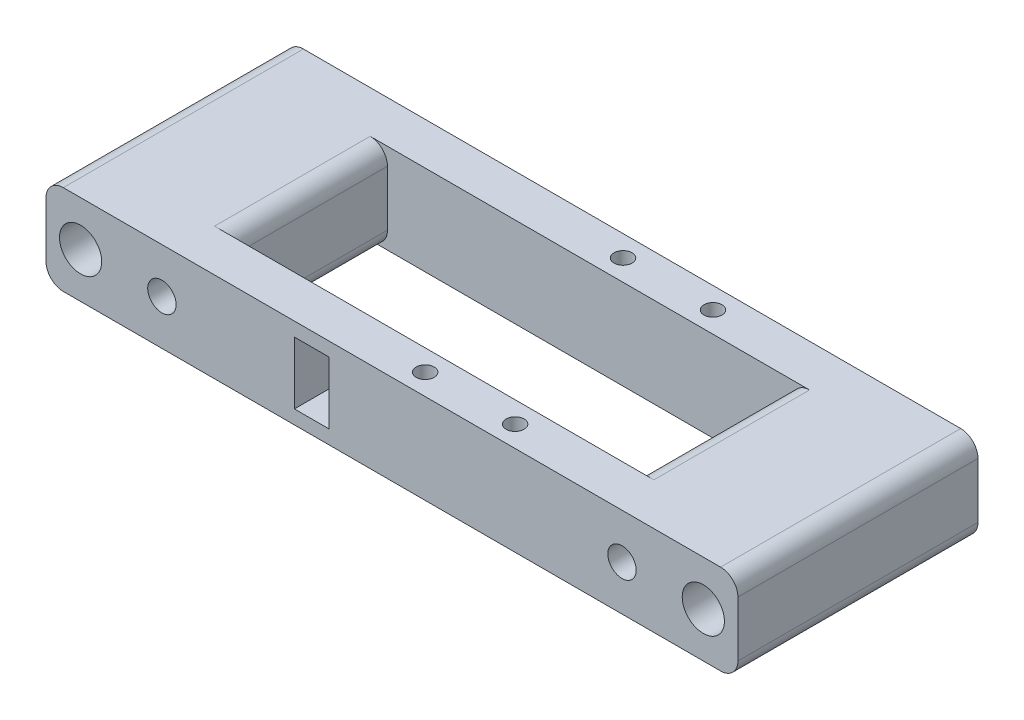
from build123d import *

# Parameters (mm, degrees)
SKETCH1_W           = 100
SKETCH1_H           = 26
SKETCH1_R           = 6.1
SKETCH1_R_2         = 4.1
BOSS_EXTRUDE1_DEPTH = 40
SKETCH2_W           = 100
SKETCH2_H           = 26
BOSS_EXTRUDE2_DEPTH = 29.4
CUT_EXTRUDE1_REACH  = 112.797
SKETCH3_W           = 58.5
SKETCH3_H           = 45
SKETCH4_R           = 2.6
CUT_EXTRUDE2_DEPTH  = 111.797111876
CUT_EXTRUDE3_DEPTH  = 4
CUT_EXTRUDE4_START  = -12.2
SKETCH6_W           = 10
SKETCH6_H           = 18
CUT_EXTRUDE4_DEPTH  = 12.2
FILLET1_R           = 5


with BuildPart() as part:
    # Sketch1 → Boss-Extrude1 (new body)
    with BuildSketch(Plane.XY):
        with Locations((-50, 13)):
            Rectangle(SKETCH1_W, SKETCH1_H)
        with Locations((-90, 13)):
            Circle(SKETCH1_R, mode=Mode.SUBTRACT)
        with Locations((-66.5, 13)):
            Circle(SKETCH1_R_2, mode=Mode.SUBTRACT)
    boss_extrude1 = extrude(amount=BOSS_EXTRUDE1_DEPTH)

    # Sketch2 → Boss-Extrude2 (add)
    with BuildSketch(Plane(origin=(0, 0, 0), x_dir=(-1, 0, 0), z_dir=(0, 0, -1))):
        with Locations((50, 13)):
            Rectangle(SKETCH2_W, SKETCH2_H)
    boss_extrude2 = extrude(amount=BOSS_EXTRUDE2_DEPTH)

    # Sketch3 → Cut-Extrude1 (cut, up to next)
    with BuildSketch(Plane(origin=(0, 26, 0), x_dir=(1, 0, 0), z_dir=(0, 1, 0)), mode=Mode.PRIVATE) as cut_extrude1_sk1:
        with Locations((-29.25, -5.3)):
            Rectangle(SKETCH3_W, SKETCH3_H)
    cut_extrude1_tool1 = extrude(cut_extrude1_sk1.sketch, amount=-CUT_EXTRUDE1_REACH, mode=Mode.PRIVATE) & part.part
    cut_extrude1 = cut_extrude1_tool1.solids().sort_by_distance((-29.25, 26, 5.3))[0]
    add(cut_extrude1, mode=Mode.SUBTRACT)

    # Mirror2: Boss-Extrude1, Boss-Extrude2, Cut-Extrude1 across plane
    add(boss_extrude1.mirror(Plane(origin=(0, 0, 40), x_dir=(0, 0, 1), z_dir=(-1, 0, 0))))
    add(boss_extrude2.mirror(Plane(origin=(0, 0, 40), x_dir=(0, 0, 1), z_dir=(-1, 0, 0))))
    add(cut_extrude1.mirror(Plane(origin=(0, 0, 40), x_dir=(0, 0, 1), z_dir=(-1, 0, 0))), mode=Mode.SUBTRACT)

    # Sketch4 → Cut-Extrude2 (cut, through all)
    with BuildSketch(Plane(origin=(0, 26, 0), x_dir=(1, 0, 0), z_dir=(0, 1, 0))):
        with Locations(Location((3.5, 23.3, 0), (0, 0, 180))):
            Circle(SKETCH4_R)
        with Locations(Location((29.5, 23.3, 0), (0, 0, 180))):
            Circle(SKETCH4_R)
    cut_extrude2 = extrude(amount=-CUT_EXTRUDE2_DEPTH, mode=Mode.SUBTRACT)

    # Sketch5 → Cut-Extrude3 (cut)
    with BuildSketch(Plane.XZ):
        Polygon((34.234272207, -23.3), (31.867136104, -19.2), (27.132863896, -19.2), (24.765727793, -23.3), (27.132863896, -27.4), (31.867136104, -27.4), align=None)
        Polygon((-1.234272207, -23.3), (1.132863896, -27.4), (5.867136104, -27.4), (8.234272207, -23.3), (5.867136104, -19.2), (1.132863896, -19.2), align=None)
    cut_extrude3 = extrude(amount=-CUT_EXTRUDE3_DEPTH, mode=Mode.SUBTRACT)

    # Mirror3: Cut-Extrude2, Cut-Extrude3 across plane
    add(cut_extrude2.mirror(Plane.XY.offset(5.3)), mode=Mode.SUBTRACT)
    add(cut_extrude3.mirror(Plane.XY.offset(5.3)), mode=Mode.SUBTRACT)

    # Sketch6 → Cut-Extrude4 (cut)
    with BuildSketch(Plane.XY.offset(40).offset(CUT_EXTRUDE4_START)):
        with Locations((-23.2, 13)):
            Rectangle(SKETCH6_W, SKETCH6_H)
    extrude(amount=CUT_EXTRUDE4_DEPTH, mode=Mode.SUBTRACT)

    # Fillet1
    fillet1_edges = [part.edges().sort_by_distance(p)[0] for p in [
        (-58.5, 26, 5.3),
        (-58.5, 0, 5.3),
        (100, 0, 5.3),
        (100, 26, 5.3),
        (-100, 0, 5.3),
        (-100, 26, 5.3),
        (58.5, 0, 5.3),
        (58.5, 26, 5.3),
    ]]
    fillet(fillet1_edges, radius=FILLET1_R)


solid = part.part
